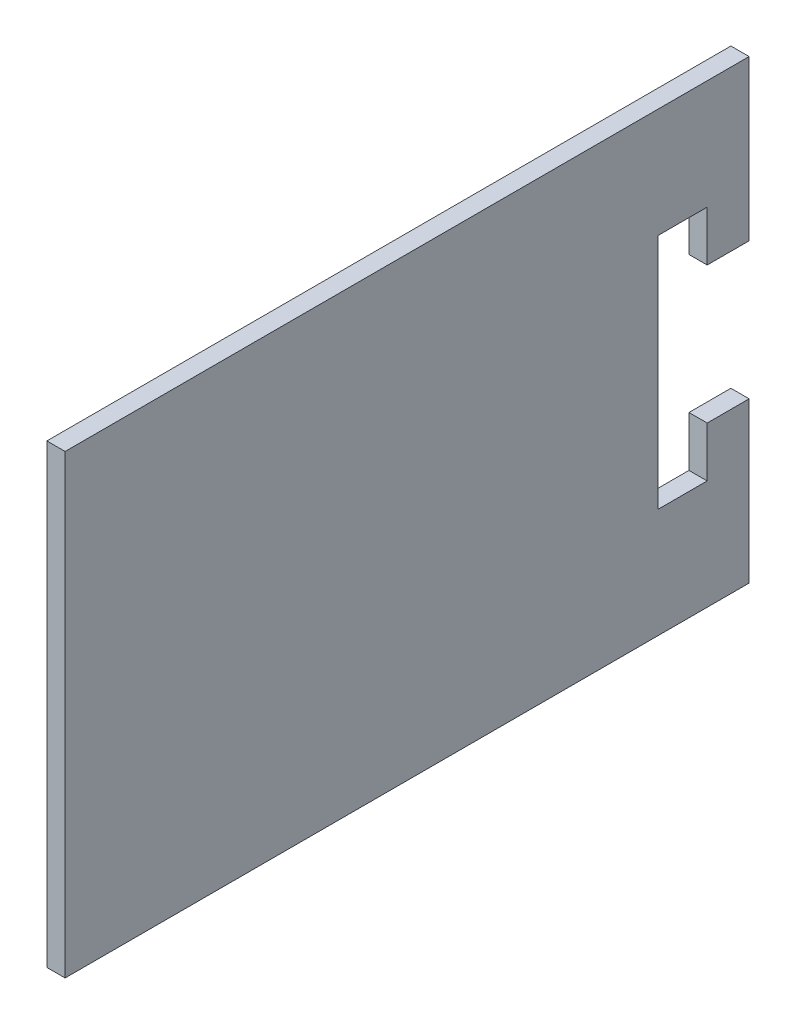
from build123d import *

# Parameters (mm, degrees)
SKETCH1_W           = 63.5
SKETCH1_H           = 95.25
BOSS_EXTRUDE1_DEPTH = 2.54
CUT_EXTRUDE1_DEPTH  = 13.97
SKETCH5_W           = 15.24
SKETCH5_H           = 15.24
BOSS_EXTRUDE2_DEPTH = 15.24
SKETCH6_W           = 12.7
SKETCH6_H           = 10.16
CUT_EXTRUDE2_DEPTH  = 12.7


with BuildPart() as part:
    # Sketch1 → Boss-Extrude1 (new body)
    with BuildSketch(Plane.YZ):
        with Locations((31.75, 47.625)):
            Rectangle(SKETCH1_W, SKETCH1_H)
    extrude(amount=BOSS_EXTRUDE1_DEPTH)

    # Sketch4 → Cut-Extrude1 (cut)
    with BuildSketch(Plane.YZ.offset(2.54)):
        Polygon((22.225, 0), (41.275, 0), (41.275, 5.842), (48.26, 5.842), (48.26, 12.7), (41.402, 12.7), (22.098, 12.7), (15.24, 12.7), (15.24, 5.842), (22.225, 5.842), align=None)
    extrude(amount=-CUT_EXTRUDE1_DEPTH, mode=Mode.SUBTRACT)

    # Sketch5 → Boss-Extrude2 (add)
    with BuildSketch(Plane(origin=(0, 0, 0), x_dir=(0, -1, 0), z_dir=(-1, 0, 0))):
        with Locations((-33.02, 20.32)):
            Rectangle(SKETCH5_W, SKETCH5_H)
    extrude(amount=BOSS_EXTRUDE2_DEPTH)

    # Sketch6 → Cut-Extrude2 (cut)
    with BuildSketch(Plane(origin=(0, 0, 12.7), x_dir=(1, 0, 0), z_dir=(0, 0, -1))):
        with Locations((-6.35, -33.02)):
            Rectangle(SKETCH6_W, SKETCH6_H)
    extrude(amount=-CUT_EXTRUDE2_DEPTH, mode=Mode.SUBTRACT)


solid = part.part
